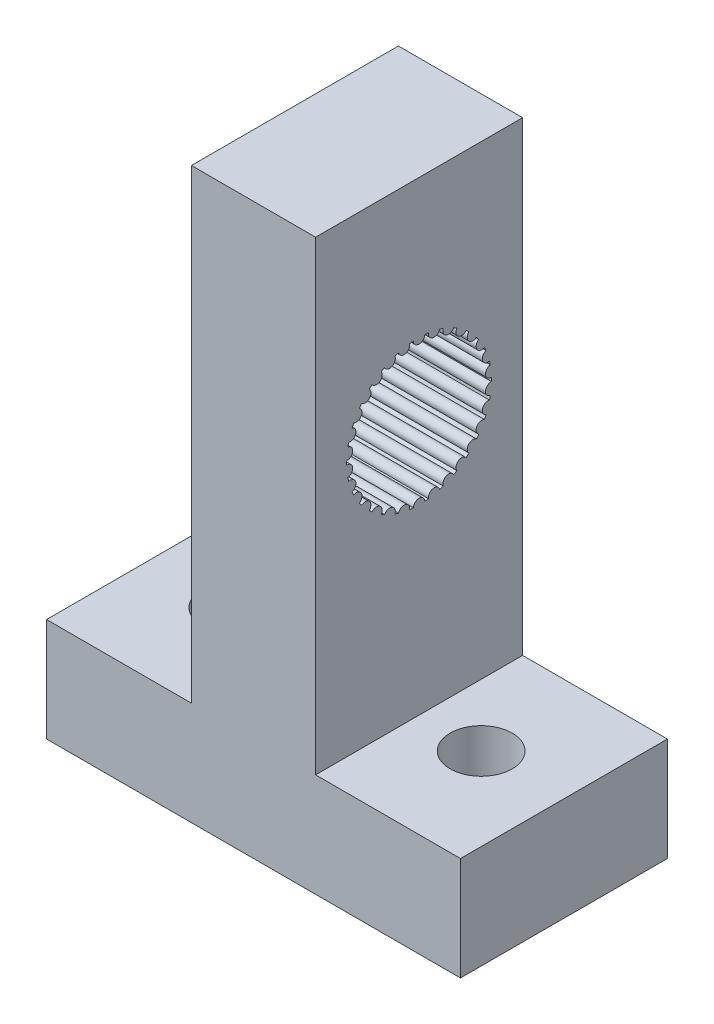
from build123d import *

# Parameters (mm, degrees)
SALIENTE_EXTRUIR1_DEPTH      = 5
CROQUIS4_R                   = 3.5
CORTAR_EXTRUIR3_DEPTH        = 15
CROQUIS5_R                   = 1.5
CORTAR_EXTRUIR4_DEPTH        = 10
SALIENTE_EXTRUIR2_DEPTH      = 3
SALIENTE_EXTRUIR2_DEPTH_BACK = 3


with BuildPart() as part:
    # Croquis1 → Saliente-Extruir1 (new, symmetric)
    with BuildSketch(Plane.XY):
        Polygon((3, -8.75), (3, 13.75), (0, 13.75), (0, -13.75), (10, -13.75), (10, -8.75), align=None)
        Polygon((0, -13.75), (0, 13.75), (-3, 13.75), (-3, -8.75), (-10, -8.75), (-10, -13.75), align=None)
    extrude(amount=SALIENTE_EXTRUIR1_DEPTH, both=True)

    # Croquis4 → Cortar-Extruir3 (cut)
    with BuildSketch(Plane(origin=(3, 0, 0), x_dir=(0, 0, -1), z_dir=(1, 0, 0))):
        with Locations(Location((0, 3.55, 0), (0, 0, 90))):
            Circle(CROQUIS4_R)
    extrude(amount=-CORTAR_EXTRUIR3_DEPTH, mode=Mode.SUBTRACT)

    # Croquis5 → Cortar-Extruir4 (cut)
    with BuildSketch(Plane.XZ.offset(13.75)):
        with Locations((-6, 0)):
            Circle(CROQUIS5_R)
        with Locations(Location((6, 0, 0), (0, 0, 180))):
            Circle(CROQUIS5_R)
    extrude(amount=-CORTAR_EXTRUIR4_DEPTH, mode=Mode.SUBTRACT)

    # Croquis6 → Saliente-Extruir2 (add, two sides: drawn at the far end of the back side and taken through both)
    with BuildSketch(Plane(origin=(0, 0, 0), x_dir=(0, 0, -1), z_dir=(1, 0, 0)).offset(-SALIENTE_EXTRUIR2_DEPTH_BACK)):
        with BuildLine():
            ThreePointArc((0.274787705, 7.039196429), (0, 7.05), (-0.274787705, 7.039196429))
            ThreePointArc((-0.274787705, 7.039196429), (0, 6.775), (0.274787705, 7.039196429))
        make_face()
        with BuildLine():
            ThreePointArc((0.994227663, 6.905817539), (0.727690918, 6.973516603), (0.456661795, 7.020080691))
            ThreePointArc((0.456661795, 7.020080691), (0.670515203, 6.704526012), (0.994227663, 6.905817539))
        make_face()
        with BuildLine():
            ThreePointArc((1.670215102, 6.625773319), (1.423578251, 6.747409102), (1.168152983, 6.849305777))
            ThreePointArc((1.168152983, 6.849305777), (1.311725674, 6.496184101), (1.670215102, 6.625773319))
        make_face()
        with BuildLine():
            ThreePointArc((2.273206126, 6.211303047), (2.057248383, 6.38155948), (1.82859028, 6.534335368))
            ThreePointArc((1.82859028, 6.534335368), (1.895607439, 6.159079807), (2.273206126, 6.211303047))
        make_face()
        with BuildLine():
            ThreePointArc((2.776847135, 5.680521061), (2.601006889, 5.891957122), (2.409109407, 6.088935183))
            ThreePointArc((2.409109407, 6.088935183), (2.396642062, 5.707946206), (2.776847135, 5.680521061))
        make_face()
        with BuildLine():
            ThreePointArc((3.159126598, 5.056625081), (3.031088913, 5.3), (2.884338893, 5.532571348))
            ThreePointArc((2.884338893, 5.532571348), (2.792931927, 5.1625), (3.159126598, 5.056625081))
        make_face()
        with BuildLine():
            ThreePointArc((3.403337071, 4.366882356), (3.328697807, 4.63155948), (3.233508929, 4.889559631))
            ThreePointArc((3.233508929, 4.889559631), (3.067157265, 4.546579807), (3.403337071, 4.366882356))
        make_face()
        with BuildLine():
            ThreePointArc((3.498805382, 3.641437951), (3.480826634, 3.915849621), (3.441359109, 4.18800273))
            ThreePointArc((3.441359109, 4.18800273), (3.207333113, 3.887104294), (3.498805382, 3.641437951))
        make_face()
        with BuildLine():
            ThreePointArc((3.441359109, 2.91199727), (3.480826634, 3.184150379), (3.498805382, 3.458562049))
            ThreePointArc((3.498805382, 3.458562049), (3.207333113, 3.212895706), (3.441359109, 2.91199727))
        make_face()
        with BuildLine():
            ThreePointArc((3.233508929, 2.210440369), (3.328697807, 2.46844052), (3.403337071, 2.733117644))
            ThreePointArc((3.403337071, 2.733117644), (3.067157265, 2.553420193), (3.233508929, 2.210440369))
        make_face()
        with BuildLine():
            ThreePointArc((2.884338893, 1.567428652), (3.031088913, 1.8), (3.159126598, 2.043374919))
            ThreePointArc((3.159126598, 2.043374919), (2.792931927, 1.9375), (2.884338893, 1.567428652))
        make_face()
        with BuildLine():
            ThreePointArc((2.409109407, 1.011064817), (2.601006889, 1.208042878), (2.776847135, 1.419478939))
            ThreePointArc((2.776847135, 1.419478939), (2.396642062, 1.392053794), (2.409109407, 1.011064817))
        make_face()
        with BuildLine():
            ThreePointArc((1.82859028, 0.565664632), (2.057248383, 0.71844052), (2.273206126, 0.888696953))
            ThreePointArc((2.273206126, 0.888696953), (1.895607439, 0.940920193), (1.82859028, 0.565664632))
        make_face()
        with BuildLine():
            ThreePointArc((1.168152983, 0.250694223), (1.423578251, 0.352590898), (1.670215102, 0.474226681))
            ThreePointArc((1.670215102, 0.474226681), (1.311725674, 0.603815899), (1.168152983, 0.250694223))
        make_face()
        with BuildLine():
            ThreePointArc((0.456661795, 0.079919309), (0.727690918, 0.126483397), (0.994227663, 0.194182461))
            ThreePointArc((0.994227663, 0.194182461), (0.670515203, 0.395473988), (0.456661795, 0.079919309))
        make_face()
        with BuildLine():
            ThreePointArc((-0.274787705, 0.060803571), (0, 0.05), (0.274787705, 0.060803571))
            ThreePointArc((0.274787705, 0.060803571), (0, 0.325), (-0.274787705, 0.060803571))
        make_face()
        with BuildLine():
            ThreePointArc((-0.994227663, 0.194182461), (-0.727690918, 0.126483397), (-0.456661795, 0.079919309))
            ThreePointArc((-0.456661795, 0.079919309), (-0.670515203, 0.395473988), (-0.994227663, 0.194182461))
        make_face()
        with BuildLine():
            ThreePointArc((-1.670215102, 0.474226681), (-1.423578251, 0.352590898), (-1.168152983, 0.250694223))
            ThreePointArc((-1.168152983, 0.250694223), (-1.311725674, 0.603815899), (-1.670215102, 0.474226681))
        make_face()
        with BuildLine():
            ThreePointArc((-2.273206126, 0.888696953), (-2.057248383, 0.71844052), (-1.82859028, 0.565664632))
            ThreePointArc((-1.82859028, 0.565664632), (-1.895607439, 0.940920193), (-2.273206126, 0.888696953))
        make_face()
        with BuildLine():
            ThreePointArc((-2.776847135, 1.419478939), (-2.601006889, 1.208042878), (-2.409109407, 1.011064817))
            ThreePointArc((-2.409109407, 1.011064817), (-2.396642062, 1.392053794), (-2.776847135, 1.419478939))
        make_face()
        with BuildLine():
            ThreePointArc((-3.159126598, 2.043374919), (-3.031088913, 1.8), (-2.884338893, 1.567428652))
            ThreePointArc((-2.884338893, 1.567428652), (-2.792931927, 1.9375), (-3.159126598, 2.043374919))
        make_face()
        with BuildLine():
            ThreePointArc((-3.403337071, 2.733117644), (-3.328697807, 2.46844052), (-3.233508929, 2.210440369))
            ThreePointArc((-3.233508929, 2.210440369), (-3.067157265, 2.553420193), (-3.403337071, 2.733117644))
        make_face()
        with BuildLine():
            ThreePointArc((-3.498805382, 3.458562049), (-3.480826634, 3.184150379), (-3.441359109, 2.91199727))
            ThreePointArc((-3.441359109, 2.91199727), (-3.207333113, 3.212895706), (-3.498805382, 3.458562049))
        make_face()
        with BuildLine():
            ThreePointArc((-3.441359109, 4.18800273), (-3.480826634, 3.915849621), (-3.498805382, 3.641437951))
            ThreePointArc((-3.498805382, 3.641437951), (-3.207333113, 3.887104294), (-3.441359109, 4.18800273))
        make_face()
        with BuildLine():
            ThreePointArc((-3.233508929, 4.889559631), (-3.328697807, 4.63155948), (-3.403337071, 4.366882356))
            ThreePointArc((-3.403337071, 4.366882356), (-3.067157265, 4.546579807), (-3.233508929, 4.889559631))
        make_face()
        with BuildLine():
            ThreePointArc((-2.884338893, 5.532571348), (-3.031088913, 5.3), (-3.159126598, 5.056625081))
            ThreePointArc((-3.159126598, 5.056625081), (-2.792931927, 5.1625), (-2.884338893, 5.532571348))
        make_face()
        with BuildLine():
            ThreePointArc((-2.409109407, 6.088935183), (-2.601006889, 5.891957122), (-2.776847135, 5.680521061))
            ThreePointArc((-2.776847135, 5.680521061), (-2.396642062, 5.707946206), (-2.409109407, 6.088935183))
        make_face()
        with BuildLine():
            ThreePointArc((-1.82859028, 6.534335368), (-2.057248383, 6.38155948), (-2.273206126, 6.211303047))
            ThreePointArc((-2.273206126, 6.211303047), (-1.895607439, 6.159079807), (-1.82859028, 6.534335368))
        make_face()
        with BuildLine():
            ThreePointArc((-1.168152983, 6.849305777), (-1.423578251, 6.747409102), (-1.670215102, 6.625773319))
            ThreePointArc((-1.670215102, 6.625773319), (-1.311725674, 6.496184101), (-1.168152983, 6.849305777))
        make_face()
        with BuildLine():
            ThreePointArc((-0.456661795, 7.020080691), (-0.727690918, 6.973516603), (-0.994227663, 6.905817539))
            ThreePointArc((-0.994227663, 6.905817539), (-0.670515203, 6.704526012), (-0.456661795, 7.020080691))
        make_face()
    extrude(amount=SALIENTE_EXTRUIR2_DEPTH + SALIENTE_EXTRUIR2_DEPTH_BACK)


solid = part.part
